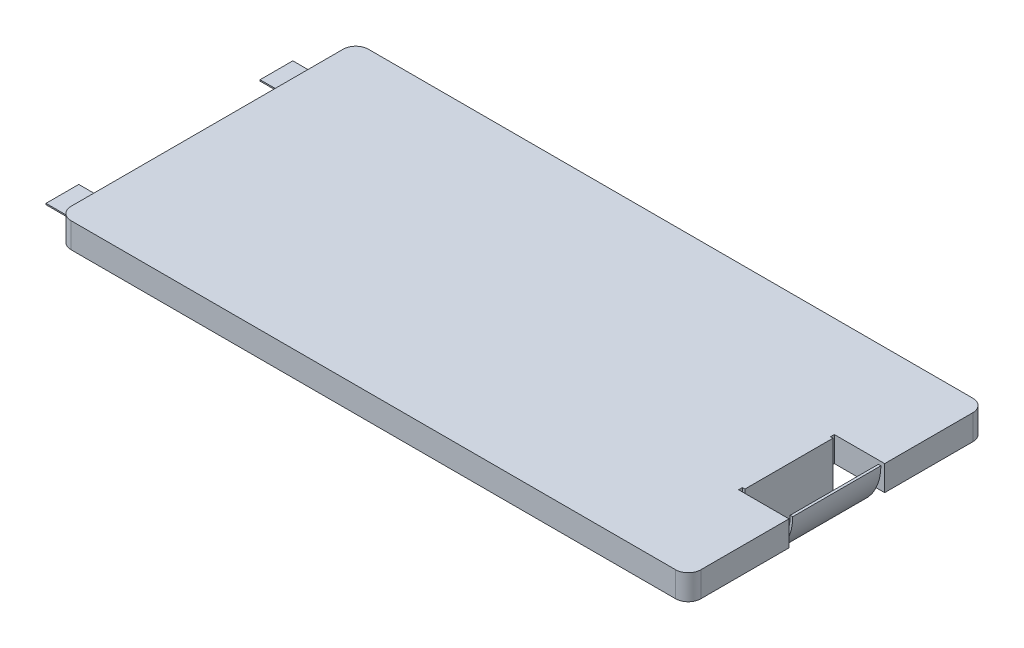
from build123d import *

# Parameters (mm, degrees)
SKETCH1_W             = 63.5
SKETCH1_H             = 29.972
BOSS_EXTRUDE1_DEPTH   = 2.54
FILLET1_R             = 1.27
SKETCH2_W             = 10.16
SKETCH2_H             = 9.652
CUT_EXTRUDE1_DEPTH    = 36.200771242
SKETCH3_W             = 4.773107024
SKETCH3_H             = 7.112
BOSS_EXTRUDE2_DEPTH   = 2.54
BOSS_EXTRUDE2_TAPER   = 31
SKETCH4_W             = 2.386553512
SKETCH4_H             = 7.112
CUT_EXTRUDE2_DEPTH    = 36.200771249
BOSS_EXTRUDE4_DEPTH   = 4.445
SKETCH11_W            = 3.302
SKETCH11_H            = 0.254
BOSS_EXTRUDE5_DEPTH   = 3.81
BOSS_EXTRUDE5_2_DEPTH = 3.81
SKETCH12_W            = 3.302
SKETCH12_H            = 0.127
CUT_EXTRUDE3_DEPTH    = 66.293811319


with BuildPart() as part:
    # Sketch1 → Boss-Extrude1 (new body)
    with BuildSketch(Plane(origin=(0, 0, 0), x_dir=(1, 0, 0), z_dir=(0, 1, 0))):
        Rectangle(SKETCH1_W, SKETCH1_H)
    extrude(amount=BOSS_EXTRUDE1_DEPTH)

    # Fillet1
    fillet1_edges = [part.edges().sort_by_distance(p)[0] for p in [
        (31.75, 1.27, 14.986),
        (-31.75, 1.27, 14.986),
        (-31.75, 1.27, -14.986),
        (31.75, 1.27, -14.986),
    ]]
    fillet(fillet1_edges, radius=FILLET1_R)

    # Sketch2 → Cut-Extrude1 (cut, through all)
    with BuildSketch(Plane(origin=(0, 2.54, 0), x_dir=(1, 0, 0), z_dir=(0, 1, 0))):
        with Locations((31.75, 0)):
            Rectangle(SKETCH2_W, SKETCH2_H)
    extrude(amount=-CUT_EXTRUDE1_DEPTH, mode=Mode.SUBTRACT)

    # Sketch3 → Boss-Extrude2 (add)
    with BuildSketch(Plane.XZ):
        with Locations((26.67, 0)):
            Rectangle(SKETCH3_W, SKETCH3_H)
    extrude(amount=BOSS_EXTRUDE2_DEPTH, taper=BOSS_EXTRUDE2_TAPER)

    # Sketch4 → Cut-Extrude2 (cut, through all)
    with BuildSketch(Plane(origin=(0, 0, 0), x_dir=(1, 0, 0), z_dir=(0, 1, 0))):
        with Locations((27.863276756, 0)):
            Rectangle(SKETCH4_W, SKETCH4_H)
    extrude(amount=-CUT_EXTRUDE2_DEPTH, mode=Mode.SUBTRACT)

    # Sketch10 → Boss-Extrude4 (add, symmetric)
    with BuildSketch(Plane.XY):
        with BuildLine():
            Line((26.67, 2.54), (26.67, -2.54))
            ThreePointArc((26.67, -2.54), (30.262102448, -1.052102448), (31.75, 2.54))
            Line((31.75, 2.54), (31.496, 2.54))
            ThreePointArc((31.496, 2.54), (30.171148383, -0.781480995), (26.924, -2.279311154))
            Line((26.924, -2.279311154), (26.924, 2.54))
            Line((26.924, 2.54), (26.67, 2.54))
        make_face()
    extrude(amount=BOSS_EXTRUDE4_DEPTH, both=True)


with BuildPart() as body_2:
    # Sketch11 → Boss-Extrude5 (new body)
    with BuildSketch(Plane.ZY.offset(31.75)):
        with Locations((10.795, 0.127)):
            Rectangle(SKETCH11_W, SKETCH11_H)
    extrude(amount=BOSS_EXTRUDE5_DEPTH)


with BuildPart() as body_3:
    # Sketch11 → Boss-Extrude5 2 (new body)
    with BuildSketch(Plane.ZY.offset(31.75)):
        with Locations((-10.795, 0.127)):
            Rectangle(SKETCH11_W, SKETCH11_H)
    extrude(amount=BOSS_EXTRUDE5_2_DEPTH)


with BuildPart() as cut_extrude3_tool:
    # Sketch12 → Cut-Extrude3 (new, through all)
    with BuildSketch(Plane.ZY.offset(31.75)):
        with Locations((-10.795, 0.0635)):
            Rectangle(SKETCH12_W, SKETCH12_H)
        with Locations((10.795, 0.0635)):
            Rectangle(SKETCH12_W, SKETCH12_H)
    extrude(amount=CUT_EXTRUDE3_DEPTH)


with BuildPart() as body_2_1:
    add(body_2.part)

    # Cut-Extrude3: cut by cut_extrude3_tool
    add(cut_extrude3_tool.part, mode=Mode.SUBTRACT)


with BuildPart() as body_3_1:
    add(body_3.part)

    # Cut-Extrude3: cut by cut_extrude3_tool
    add(cut_extrude3_tool.part, mode=Mode.SUBTRACT)


solid = Compound([part.part, body_2_1.part, body_3_1.part])
